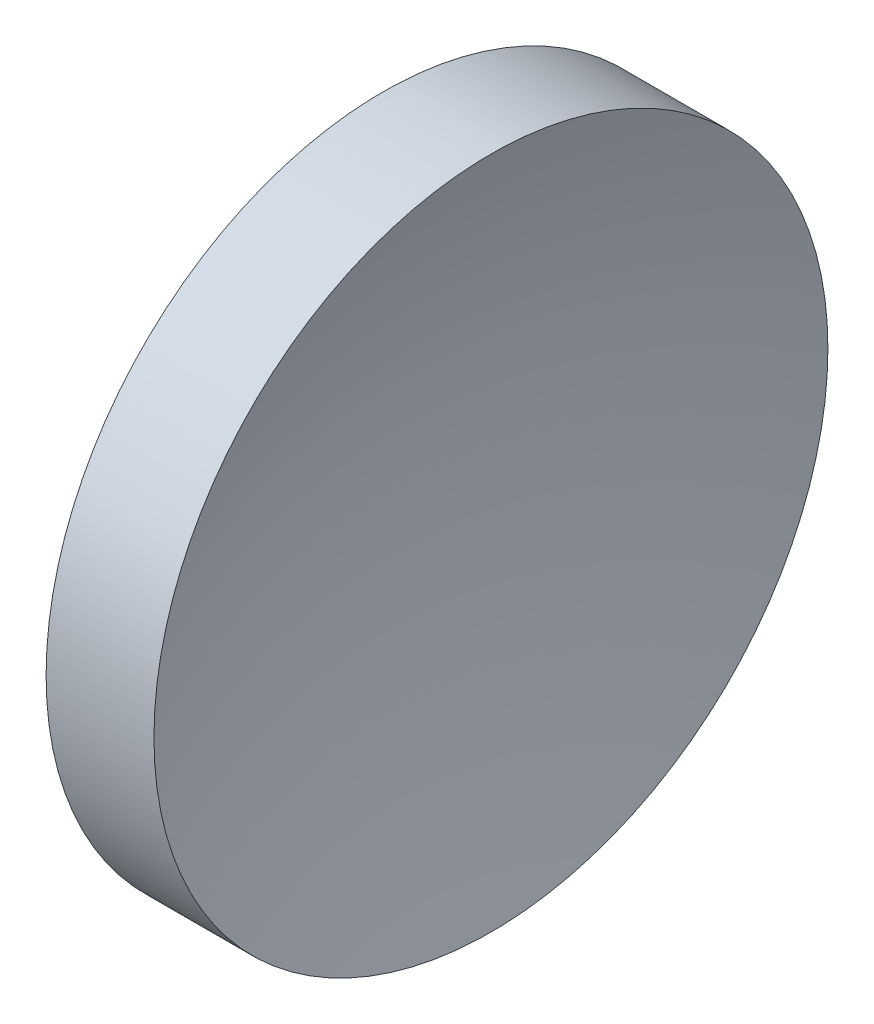
from build123d import *


with BuildPart() as part:
    # Esquisse11 → Révolution3 (revolve)
    with BuildSketch(Plane(origin=(0, 0, 0), x_dir=(1, 0, 0), z_dir=(0, 1, 0)), mode=Mode.PRIVATE) as r_volution3_sk:
        with BuildLine():
            Line((4, -12.5), (0, -12.5))
            ThreePointArc((0, -12.5), (-0.391248773, -6.255441898), (-0.521740711, 0))
            Line((-0.521740711, 0), (1.996710384, 0))
            ThreePointArc((1.996710384, 0), (2.500707957, -6.329754523), (4, -12.5))
        make_face()
    revolve(r_volution3_sk.sketch.rotate(Axis((1.996710384, 0, 0), (-1, 0, 0)), 180), axis=Axis((1.996710384, 0, 0), (-1, 0, 0)))


solid = part.part
